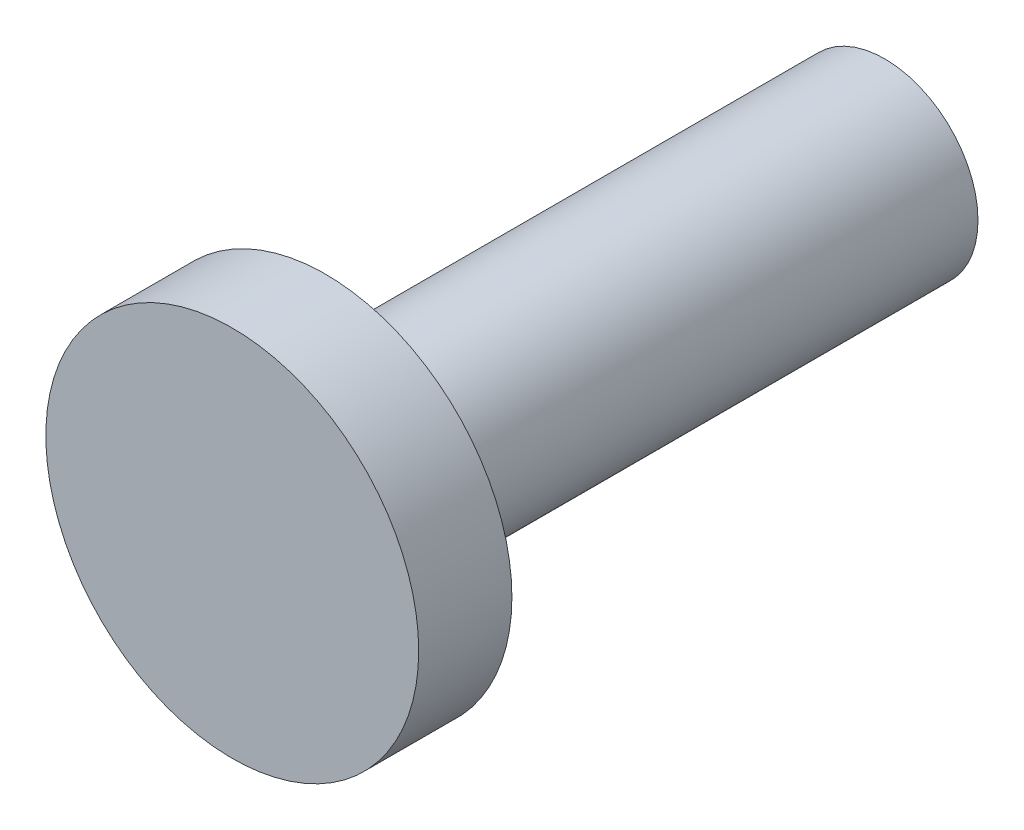
from build123d import *

# Parameters (mm, degrees)
SKETCH_1_R      = 10
EXTRUDE_1_DEPTH = 60
SKETCH_2_R      = 20
EXTRUDE_2_DEPTH = 10


with BuildPart() as part:
    # 스케치1 → 보스-돌출1 (new body)
    with BuildSketch(Plane.XY):
        Circle(SKETCH_1_R)
    extrude(amount=EXTRUDE_1_DEPTH)

    # 스케치2 → 보스-돌출2 (add)
    with BuildSketch(Plane.XY.offset(60)):
        Circle(SKETCH_2_R)
    extrude(amount=EXTRUDE_2_DEPTH)


solid = part.part
